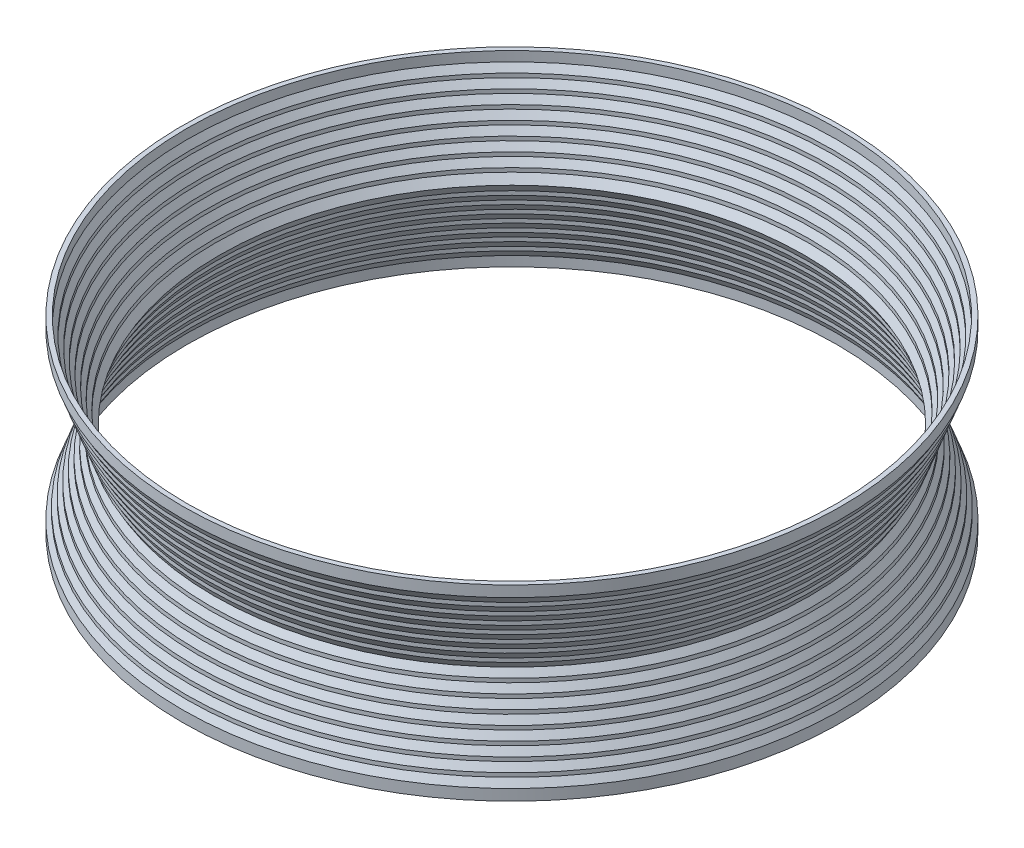
from build123d import *

# Parameters (mm, degrees)
SKETCH_1_R      = 35.893803705
EXTRUDE_1_DEPTH = 1.2
SHELL_1_T       = -0.5


with BuildPart() as part:
    # 스케치1 → 보스-돌출1 (new body)
    with BuildSketch(Plane(origin=(0, 0, 0), x_dir=(1, 0, 0), z_dir=(0, 1, 0))):
        with Locations(Location((0, 0, 0), (0, 0, 270))):
            Circle(SKETCH_1_R)
    extrude_1 = extrude(amount=EXTRUDE_1_DEPTH)

    # 스케치4 → 회전1 (revolve)
    with BuildSketch(Plane(origin=(0, 0, 0), x_dir=(0, 0, -1), z_dir=(1, 0, 0))):
        Polygon((-35.893803705, 1.2), (-35.460791003, 1.95), (-35.460791003, 2.38), (-35.027778301, 3.13), (-35.027778301, 3.56), (-34.594765599, 4.31), (-34.594765599, 4.74), (-34.161752897, 5.49), (-34.161752897, 5.92), (-33.728740195, 6.67), (-33.728740195, 7.1), (-33.295727494, 7.85), (-33.295727494, 8.28), (-32.862714792, 9.03), (-32.862714792, 9.46), (-32.42970209, 10.21), (0, 10.2), (0, 1.2), align=None)
    revolve_1 = revolve(axis=Axis((0, 10.2, 0), (0, -1, 0)))

    # 대칭 복사1: 보스-돌출1, 회전1 across plane
    add(extrude_1.mirror(Plane.ZX.offset(10.2)))
    add(revolve_1.mirror(Plane.ZX.offset(10.2)))

    # 쉘1
    shell_1_openings = [part.faces().sort_by_distance(p)[0] for p in [
        (0, 0, 0),
        (0, 20.4, 0),
    ]]
    offset(amount=SHELL_1_T, openings=shell_1_openings, kind=Kind.INTERSECTION)


solid = part.part
